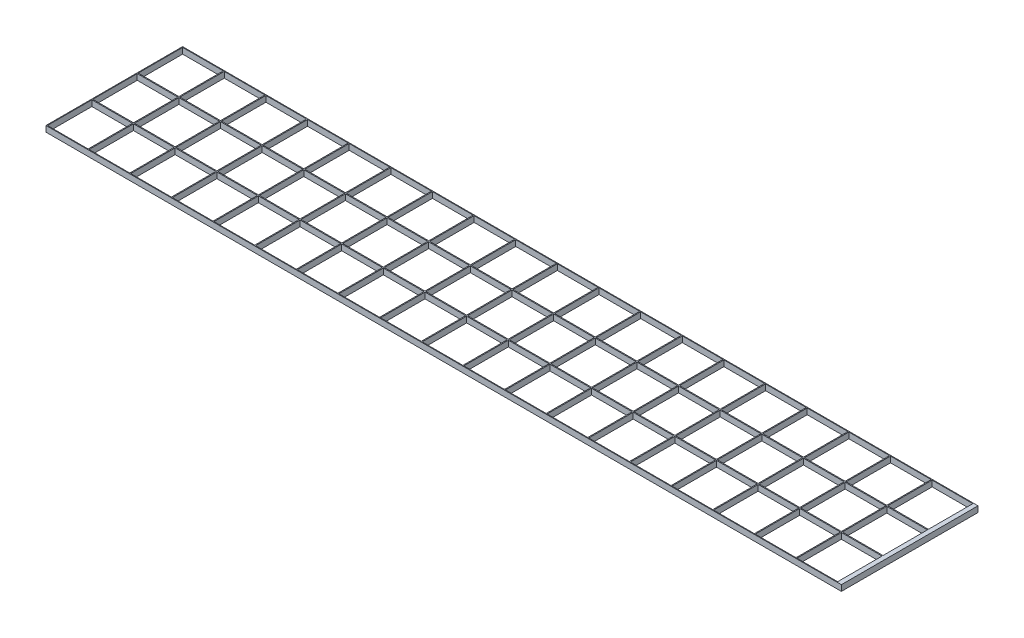
from build123d import *

# Parameters (mm, degrees)
SKETCH1_W           = 431.8
SKETCH1_H           = 74.168
BOSS_EXTRUDE1_DEPTH = 3.175
SKETCH2_W           = 22.098
SKETCH2_H           = 24.13
CUT_EXTRUDE1_DEPTH  = 3.175


with BuildPart() as part:
    # Sketch1 → Boss-Extrude1 (new body)
    with BuildSketch(Plane(origin=(0, 0, 0), x_dir=(1, 0, 0), z_dir=(0, 1, 0))):
        with Locations((215.9, 37.084)):
            Rectangle(SKETCH1_W, SKETCH1_H)
    extrude(amount=BOSS_EXTRUDE1_DEPTH)

    # Sketch2 → Cut-Extrude1 (cut)
    with BuildSketch(Plane(origin=(0, 3.175, 0), x_dir=(1, 0, 0), z_dir=(0, 1, 0))):
        with Locations((11.43, 61.722)):
            Rectangle(SKETCH2_W, SKETCH2_H)
        with Locations((11.43, 37.084)):
            Rectangle(SKETCH2_W, SKETCH2_H)
        with Locations((11.43, 12.446)):
            Rectangle(SKETCH2_W, SKETCH2_H)
        with Locations((34.036, 61.722)):
            Rectangle(SKETCH2_W, SKETCH2_H)
        with Locations((34.036, 37.084)):
            Rectangle(SKETCH2_W, SKETCH2_H)
        with Locations((34.036, 12.446)):
            Rectangle(SKETCH2_W, SKETCH2_H)
        with Locations((56.642, 61.722)):
            Rectangle(SKETCH2_W, SKETCH2_H)
        with Locations((56.642, 37.084)):
            Rectangle(SKETCH2_W, SKETCH2_H)
        with Locations((56.642, 12.446)):
            Rectangle(SKETCH2_W, SKETCH2_H)
        with Locations((79.248, 61.722)):
            Rectangle(SKETCH2_W, SKETCH2_H)
        with Locations((79.248, 37.084)):
            Rectangle(SKETCH2_W, SKETCH2_H)
        with Locations((79.248, 12.446)):
            Rectangle(SKETCH2_W, SKETCH2_H)
        with Locations((101.854, 61.722)):
            Rectangle(SKETCH2_W, SKETCH2_H)
        with Locations((101.854, 37.084)):
            Rectangle(SKETCH2_W, SKETCH2_H)
        with Locations((101.854, 12.446)):
            Rectangle(SKETCH2_W, SKETCH2_H)
        with Locations((124.46, 61.722)):
            Rectangle(SKETCH2_W, SKETCH2_H)
        with Locations((124.46, 37.084)):
            Rectangle(SKETCH2_W, SKETCH2_H)
        with Locations((124.46, 12.446)):
            Rectangle(SKETCH2_W, SKETCH2_H)
        with Locations((147.066, 61.722)):
            Rectangle(SKETCH2_W, SKETCH2_H)
        with Locations((147.066, 37.084)):
            Rectangle(SKETCH2_W, SKETCH2_H)
        with Locations((147.066, 12.446)):
            Rectangle(SKETCH2_W, SKETCH2_H)
        with Locations((169.672, 61.722)):
            Rectangle(SKETCH2_W, SKETCH2_H)
        with Locations((169.672, 37.084)):
            Rectangle(SKETCH2_W, SKETCH2_H)
        with Locations((169.672, 12.446)):
            Rectangle(SKETCH2_W, SKETCH2_H)
        with Locations((192.278, 61.722)):
            Rectangle(SKETCH2_W, SKETCH2_H)
        with Locations((192.278, 37.084)):
            Rectangle(SKETCH2_W, SKETCH2_H)
        with Locations((192.278, 12.446)):
            Rectangle(SKETCH2_W, SKETCH2_H)
        with Locations((214.884, 61.722)):
            Rectangle(SKETCH2_W, SKETCH2_H)
        with Locations((214.884, 37.084)):
            Rectangle(SKETCH2_W, SKETCH2_H)
        with Locations((214.884, 12.446)):
            Rectangle(SKETCH2_W, SKETCH2_H)
        with Locations((237.49, 61.722)):
            Rectangle(SKETCH2_W, SKETCH2_H)
        with Locations((237.49, 37.084)):
            Rectangle(SKETCH2_W, SKETCH2_H)
        with Locations((237.49, 12.446)):
            Rectangle(SKETCH2_W, SKETCH2_H)
        with Locations((260.096, 61.722)):
            Rectangle(SKETCH2_W, SKETCH2_H)
        with Locations((260.096, 37.084)):
            Rectangle(SKETCH2_W, SKETCH2_H)
        with Locations((260.096, 12.446)):
            Rectangle(SKETCH2_W, SKETCH2_H)
        with Locations((282.702, 61.722)):
            Rectangle(SKETCH2_W, SKETCH2_H)
        with Locations((282.702, 37.084)):
            Rectangle(SKETCH2_W, SKETCH2_H)
        with Locations((282.702, 12.446)):
            Rectangle(SKETCH2_W, SKETCH2_H)
        with Locations((305.308, 61.722)):
            Rectangle(SKETCH2_W, SKETCH2_H)
        with Locations((305.308, 37.084)):
            Rectangle(SKETCH2_W, SKETCH2_H)
        with Locations((305.308, 12.446)):
            Rectangle(SKETCH2_W, SKETCH2_H)
        with Locations((327.914, 61.722)):
            Rectangle(SKETCH2_W, SKETCH2_H)
        with Locations((327.914, 37.084)):
            Rectangle(SKETCH2_W, SKETCH2_H)
        with Locations((327.914, 12.446)):
            Rectangle(SKETCH2_W, SKETCH2_H)
        with Locations((350.52, 61.722)):
            Rectangle(SKETCH2_W, SKETCH2_H)
        with Locations((350.52, 37.084)):
            Rectangle(SKETCH2_W, SKETCH2_H)
        with Locations((350.52, 12.446)):
            Rectangle(SKETCH2_W, SKETCH2_H)
        with Locations((373.126, 61.722)):
            Rectangle(SKETCH2_W, SKETCH2_H)
        with Locations((373.126, 37.084)):
            Rectangle(SKETCH2_W, SKETCH2_H)
        with Locations((373.126, 12.446)):
            Rectangle(SKETCH2_W, SKETCH2_H)
        with Locations((395.732, 61.722)):
            Rectangle(SKETCH2_W, SKETCH2_H)
        with Locations((395.732, 37.084)):
            Rectangle(SKETCH2_W, SKETCH2_H)
        with Locations((395.732, 12.446)):
            Rectangle(SKETCH2_W, SKETCH2_H)
        with Locations((418.338, 61.722)):
            Rectangle(SKETCH2_W, SKETCH2_H)
        with Locations((418.338, 37.084)):
            Rectangle(SKETCH2_W, SKETCH2_H)
        with Locations((418.338, 12.446)):
            Rectangle(SKETCH2_W, SKETCH2_H)
    extrude(amount=-CUT_EXTRUDE1_DEPTH, mode=Mode.SUBTRACT)


solid = part.part
